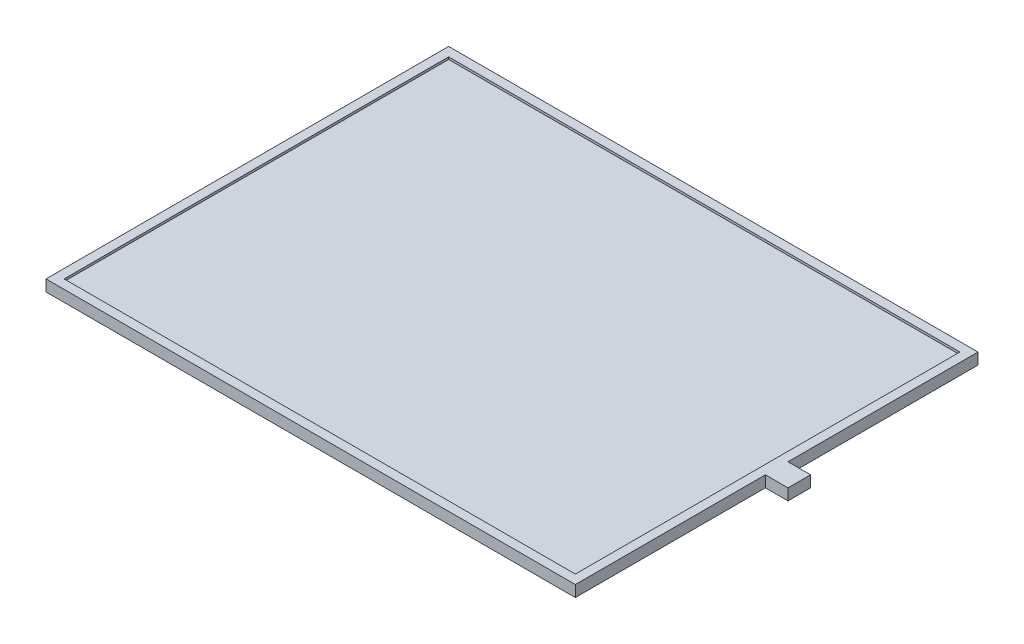
from build123d import *

# Parameters (mm, degrees)
SKETCH1_W           = 226
SKETCH1_H           = 170
BOSS_EXTRUDE1_DEPTH = 5
SKETCH2_W           = 226
SKETCH2_H           = 170
BOSS_EXTRUDE2_DEPTH = 4


with BuildPart() as part:
    # Sketch1 → Boss-Extrude1 (new body)
    with BuildSketch(Plane(origin=(0, 0, 0), x_dir=(1, 0, 0), z_dir=(0, 1, 0))):
        Polygon((234, -94), (234, -178), (0, -178), (0, 0), (234, 0), (234, -84), (244, -84), (244, -94), align=None)
        with Locations((117, -89)):
            Rectangle(SKETCH1_W, SKETCH1_H, mode=Mode.SUBTRACT)
    extrude(amount=BOSS_EXTRUDE1_DEPTH)

    # Sketch2 → Boss-Extrude2 (add)
    with BuildSketch(Plane(origin=(0, 0, 0), x_dir=(1, 0, 0), z_dir=(0, 1, 0))):
        with Locations((117, -89)):
            Rectangle(SKETCH2_W, SKETCH2_H)
    extrude(amount=BOSS_EXTRUDE2_DEPTH)


solid = part.part
